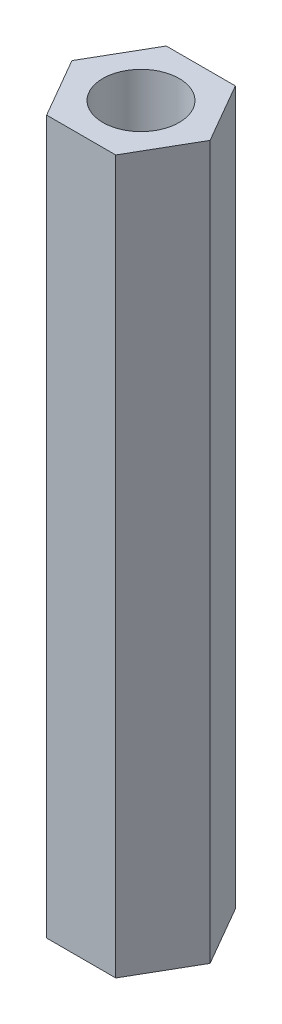
from build123d import *

# Parameters (mm, degrees)
SKETCH1_R           = 1.5
BOSS_EXTRUDE1_DEPTH = 28


with BuildPart() as part:
    # Sketch1 → Boss-Extrude1 (new body)
    with BuildSketch(Plane(origin=(0, 0, 0), x_dir=(1, 0, 0), z_dir=(0, 1, 0))):
        Polygon((-2.713546265, 0), (-1.356773133, -2.35), (1.356773133, -2.35), (2.713546265, 0), (1.356773133, 2.35), (-1.356773133, 2.35), align=None)
        with Locations(Location((0, 0, 0), (0, 0, 270))):
            Circle(SKETCH1_R, mode=Mode.SUBTRACT)
    extrude(amount=BOSS_EXTRUDE1_DEPTH)


solid = part.part
